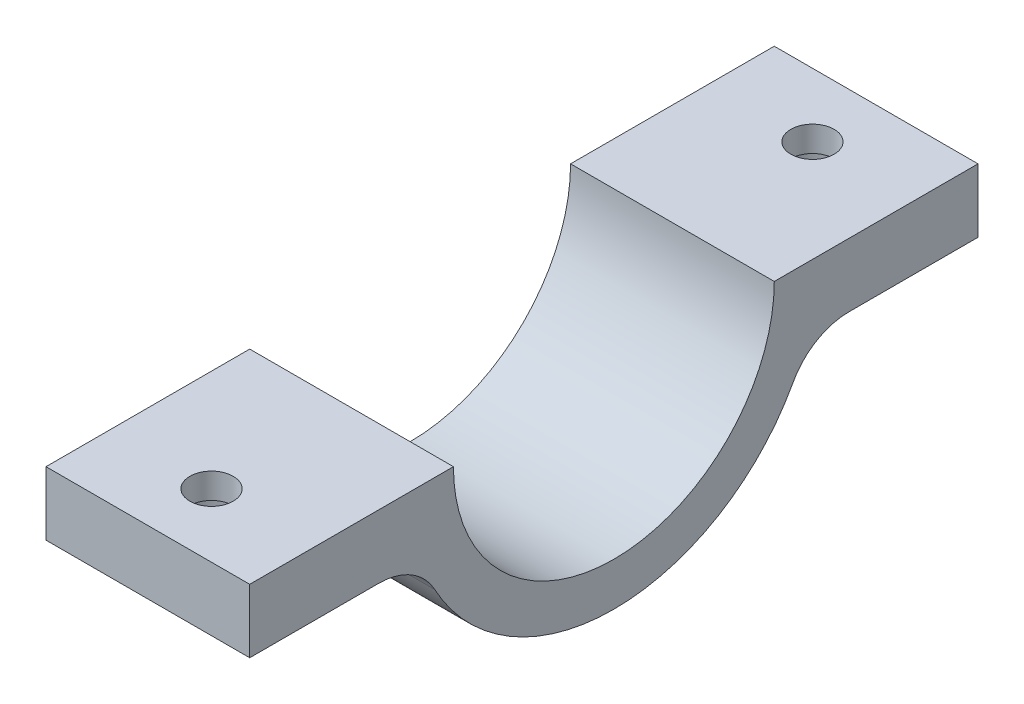
from build123d import *

# Parameters (mm, degrees)
MOUNT_BOTTOM_DEPTH             = 8
FASTENING_FILET_BOTTOM_R       = 5
CBORE_FOR_M3_SHCS1_D           = 3.4
CBORE_FOR_M3_SHCS1_CBORE_D     = 6.5
CBORE_FOR_M3_SHCS1_CBORE_DEPTH = 3


with BuildPart() as part:
    # Sketch2 → Mount_Bottom (new, symmetric)
    with BuildSketch(Plane(origin=(0, 0, 0), x_dir=(0, 0, -1), z_dir=(1, 0, 0))):
        with BuildLine():
            Line((-12.6, 0), (-28.6, 0))
            Line((-28.6, 0), (-28.6, -5))
            Line((-28.6, -5), (-15.198684154, -5))
            ThreePointArc((-15.198684154, -5), (0, -16), (15.198684154, -5))
            Line((15.198684154, -5), (28.6, -5))
            Line((28.6, -5), (28.6, 0))
            Line((28.6, 0), (12.6, 0))
            ThreePointArc((12.6, 0), (0, -12.6), (-12.6, 0))
        make_face()
    extrude(amount=MOUNT_BOTTOM_DEPTH, both=True)

    # Fastening_Filet_Bottom
    fastening_filet_bottom_edges = [part.edges().sort_by_distance(p)[0] for p in [
        (0, -5, -15.198684154),
        (0, -5, 15.198684154),
    ]]
    fillet(fastening_filet_bottom_edges, radius=FASTENING_FILET_BOTTOM_R)

    # CBORE for M3 SHCS1 (through all)
    with Locations(Plane.XZ.offset(5)):
        with Locations((0, 23.6), (0, -23.6)):
            CounterBoreHole(CBORE_FOR_M3_SHCS1_D / 2, CBORE_FOR_M3_SHCS1_CBORE_D / 2, CBORE_FOR_M3_SHCS1_CBORE_DEPTH)


solid = part.part
